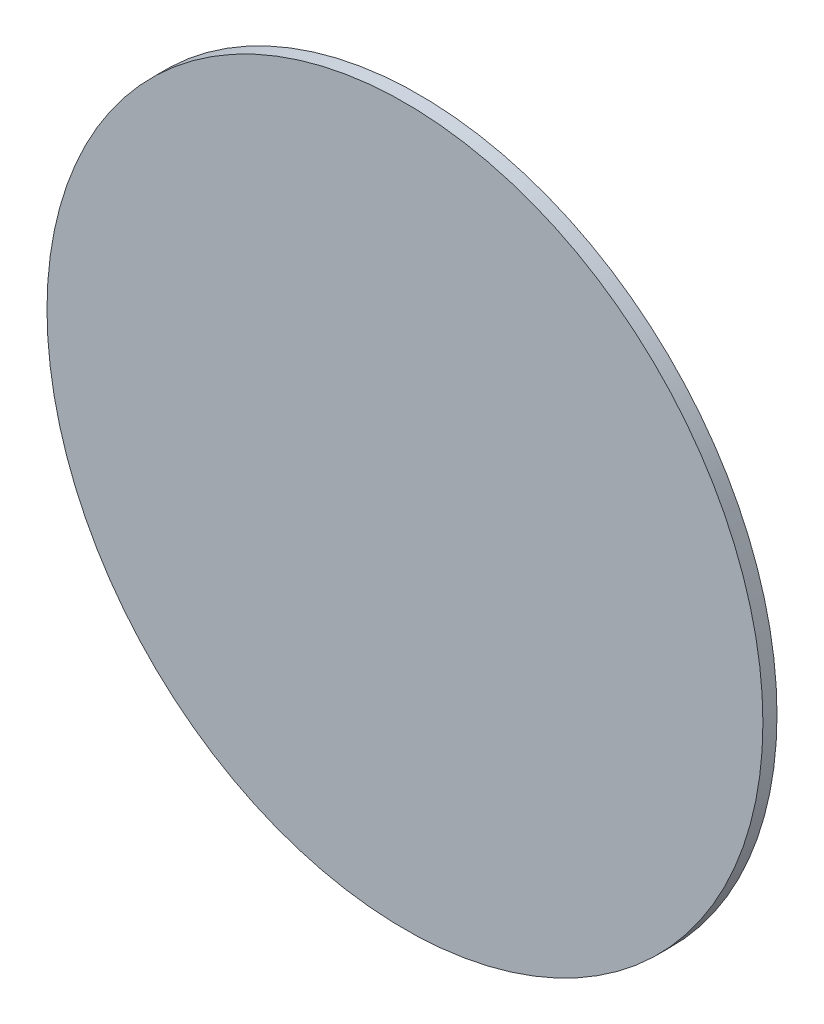
from build123d import *

# Parameters (mm, degrees)
SKETCH1_R           = 25.4
BOSS_EXTRUDE1_DEPTH = 1


with BuildPart() as part:
    # Sketch1 → Boss-Extrude1 (new body)
    with BuildSketch(Plane.XY):
        Circle(SKETCH1_R)
    extrude(amount=BOSS_EXTRUDE1_DEPTH)


solid = part.part
